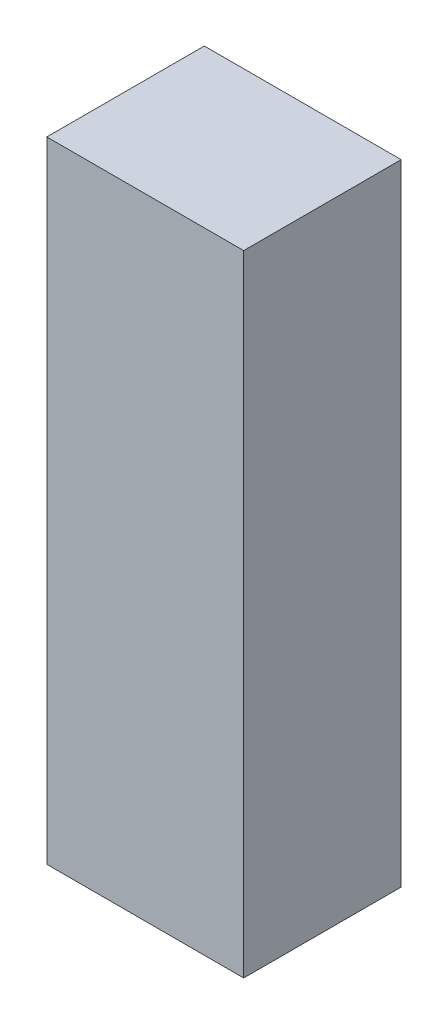
from build123d import *

# Parameters (mm, degrees)
SKETCH1_W           = 0.25
SKETCH1_H           = 0.8
BOSS_EXTRUDE1_DEPTH = 0.2


with BuildPart() as part:
    # Sketch1 → Boss-Extrude1 (new body)
    with BuildSketch(Plane.XY):
        with Locations((0.125, 0.4)):
            Rectangle(SKETCH1_W, SKETCH1_H)
    extrude(amount=BOSS_EXTRUDE1_DEPTH)


solid = part.part
